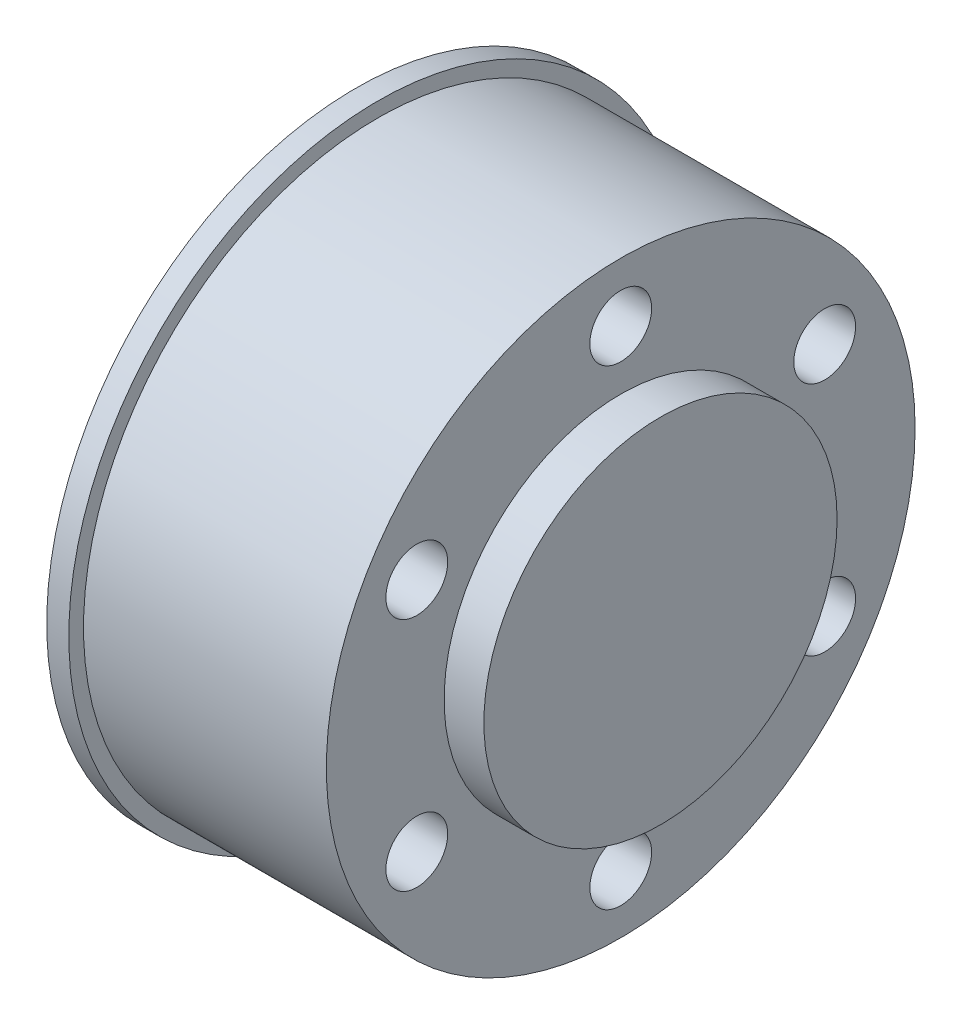
from build123d import *

# Parameters (mm, degrees)
SKETCH3_R          = 1.5
CUT_EXTRUDE1_DEPTH = 4
SKETCH4_R          = 2.1
CUT_EXTRUDE2_DEPTH = 10


with BuildPart() as part:
    # Sketch2 → Revolve1 (revolve)
    with BuildSketch(Plane(origin=(0, 0, 0), x_dir=(1, 0, 0), z_dir=(0, 1, 0))):
        Polygon((0, 0), (0, 12), (-2.7, 12), (-2.7, 20), (-19.2, 20), (-19.2, 21), (-20.7, 21), (-20.7, 17.652837292), (-20.7, 14.5), (-20.7, 8), (-15.7, 8), (-15.7, 6), (-14.7, 6), (-14.7, 0), align=None)
    revolve(axis=Axis((0, 0, 0), (-1, 0, 0)))

    # Sketch3 → Cut-Extrude1 (cut)
    with BuildSketch(Plane.ZY.offset(20.7)):
        with Locations((0, 16)):
            Circle(SKETCH3_R)
        with Locations((13.856406461, 7.904729806)):
            Circle(SKETCH3_R)
        with Locations((13.773900052, -8.142905292)):
            Circle(SKETCH3_R)
        with Locations((-0.165012817, -16.095270194)):
            Circle(SKETCH3_R)
        with Locations((-14.021419278, -8)):
            Circle(SKETCH3_R)
        with Locations((-13.938912869, 8.047635097)):
            Circle(SKETCH3_R)
    extrude(amount=-CUT_EXTRUDE1_DEPTH, mode=Mode.SUBTRACT)

    # Sketch4 → Cut-Extrude2 (cut)
    with BuildSketch(Plane(origin=(-2.7, 0, 0), x_dir=(0, 0, -1), z_dir=(1, 0, 0))):
        with Locations((0, 16)):
            Circle(SKETCH4_R)
        with Locations((13.856406461, 8)):
            Circle(SKETCH4_R)
        with Locations((13.856406461, -8)):
            Circle(SKETCH4_R)
        with Locations((0, -16)):
            Circle(SKETCH4_R)
        with Locations((-13.856406461, -8)):
            Circle(SKETCH4_R)
        with Locations((-13.856406461, 8)):
            Circle(SKETCH4_R)
    extrude(amount=-CUT_EXTRUDE2_DEPTH, mode=Mode.SUBTRACT)


solid = part.part
